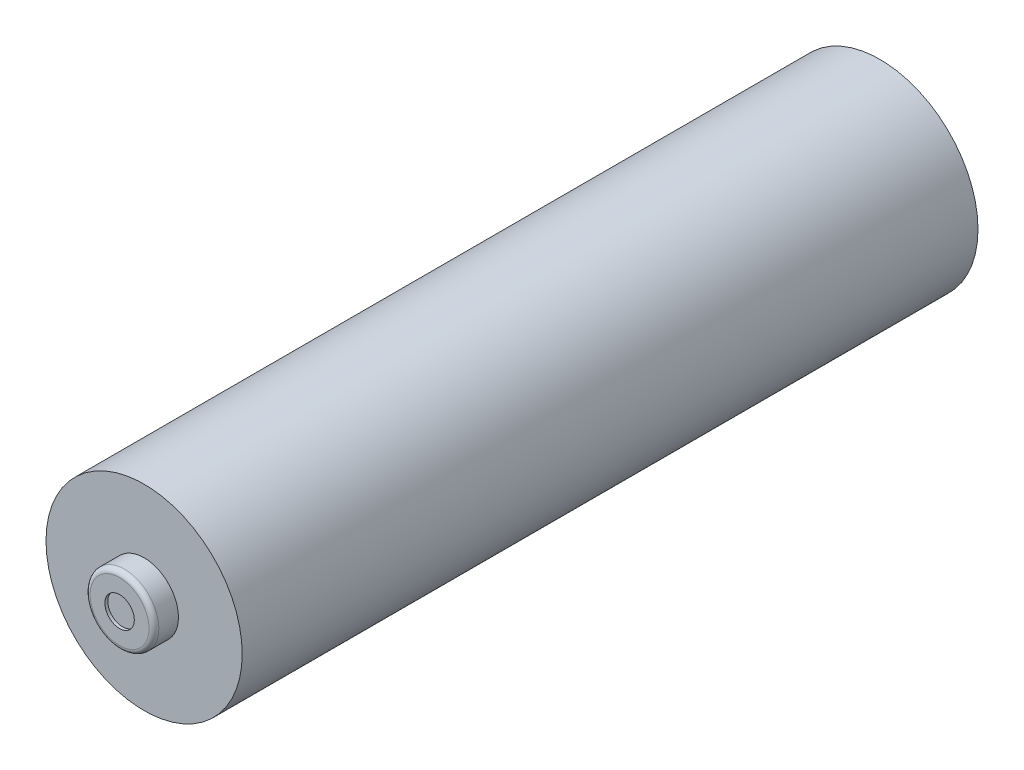
from build123d import *

# Parameters (mm, degrees)
SKETCH2_R                = 254
BOSS_EXTRUDE2_DEPTH      = 1905
BOSS_EXTRUDE3_DEPTH      = 63.5
BOSS_EXTRUDE3_DEPTH_BACK = 1968.5
SKETCH3_R                = 88.9
FILLET1_R                = 12.7
SKETCH4_R                = 38.1
CUT_EXTRUDE1_DEPTH       = 7.62
CUT_EXTRUDE2_START       = -7.62
SKETCH5_R                = 38.1
CUT_EXTRUDE2_DEPTH       = 7.62


with BuildPart() as part:
    # Sketch2 → Boss-Extrude2 (new body)
    with BuildSketch(Plane.XY):
        Circle(SKETCH2_R)
    extrude(amount=BOSS_EXTRUDE2_DEPTH)

    # Sketch3 → Boss-Extrude3 (add, two sides: drawn at the far end of the back side and taken through both)
    with BuildSketch(Plane.XY.offset(1905).offset(-BOSS_EXTRUDE3_DEPTH_BACK)):
        Circle(SKETCH3_R)
    extrude(amount=BOSS_EXTRUDE3_DEPTH + BOSS_EXTRUDE3_DEPTH_BACK)

    # Fillet1
    fillet1_edges = [part.edges().sort_by_distance(p)[0] for p in [
        (-88.9, 0, -63.5),
        (-88.9, 0, 1968.5),
    ]]
    fillet(fillet1_edges, radius=FILLET1_R)

    # Sketch4 → Cut-Extrude1 (cut)
    with BuildSketch(Plane(origin=(0, 0, -63.5), x_dir=(-1, 0, 0), z_dir=(0, 0, -1))):
        Circle(SKETCH4_R)
    extrude(amount=-CUT_EXTRUDE1_DEPTH, mode=Mode.SUBTRACT)

    # Sketch5 → Cut-Extrude2 (cut)
    with BuildSketch(Plane.XY.offset(1968.5).offset(CUT_EXTRUDE2_START)):
        with Locations(Location((0, 0, 0), (0, 0, 180))):
            Circle(SKETCH5_R)
    extrude(amount=CUT_EXTRUDE2_DEPTH, mode=Mode.SUBTRACT)


solid = part.part
